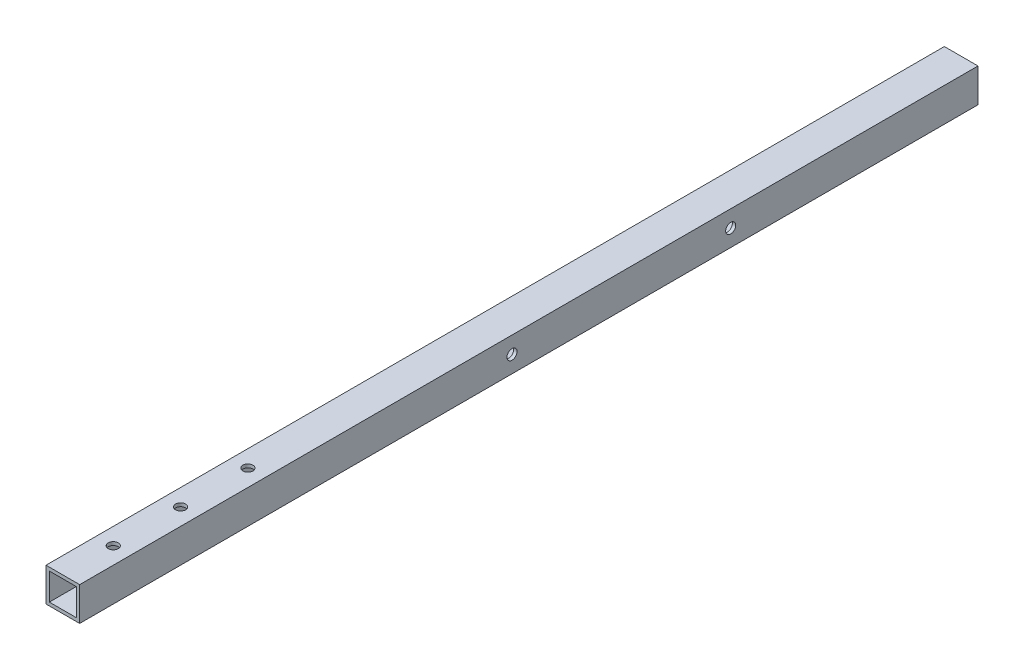
from build123d import *

# Parameters (mm, degrees)
SKETCH_1_W          = 10
SKETCH_1_H          = 10
SKETCH_1_W_2        = 8
SKETCH_1_H_2        = 8
EXTRUDE_1_DEPTH     = 133.5
SKETCH_2_R          = 1.5
CUT_EXTRUDE_1_DEPTH = 20
SKETCH_3_R          = 1.5
CUT_EXTRUDE_2_DEPTH = 40


with BuildPart() as part:
    # 草图1 → 凸台-拉伸1 (new, symmetric)
    with BuildSketch(Plane.XY):
        Rectangle(SKETCH_1_W, SKETCH_1_H)
        Rectangle(SKETCH_1_W_2, SKETCH_1_H_2, mode=Mode.SUBTRACT)
    extrude(amount=EXTRUDE_1_DEPTH, both=True)

    # 草图2 → 切除-拉伸1 (cut, symmetric)
    with BuildSketch(Plane.XZ.offset(5)):
        with Locations((0, 118.5)):
            Circle(SKETCH_2_R)
        with Locations((0, 98.5)):
            Circle(SKETCH_2_R)
        with Locations((0, 78.5)):
            Circle(SKETCH_2_R)
    extrude(amount=CUT_EXTRUDE_1_DEPTH, both=True, mode=Mode.SUBTRACT)

    # 草图3 → 切除-拉伸2 (cut)
    with BuildSketch(Plane.ZY.offset(5)):
        with Locations(Location((-60, 0, 0), (0, 0, 270))):
            Circle(SKETCH_3_R)
        with Locations(Location((5, 0, 0), (0, 0, 270))):
            Circle(SKETCH_3_R)
    extrude(amount=-CUT_EXTRUDE_2_DEPTH, mode=Mode.SUBTRACT)


solid = part.part
